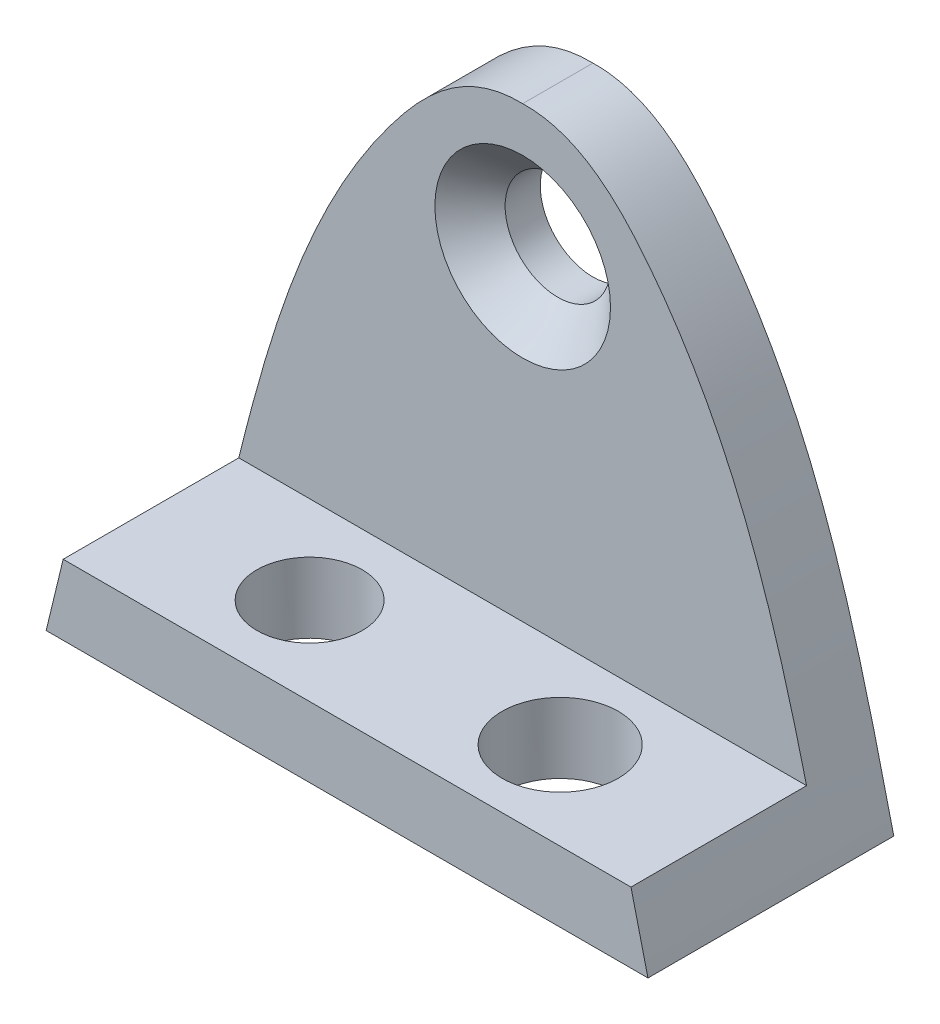
from build123d import *

# Parameters (mm, degrees)
SKETCH1_R           = 1.5
BOSS_EXTRUDE1_DEPTH = 2
CHAMFER1_SIZE       = 1
BOSS_EXTRUDE2_DEPTH = 5
SKETCH3_R           = 1.5
SKETCH3_R_2         = 1.654032004
CUT_EXTRUDE1_DEPTH  = 19.458358008


with BuildPart() as part:
    # Sketch1 → Boss-Extrude1 (new body)
    with BuildSketch(Plane.XY):
        with BuildLine():
            Line((8.566894072, -11), (-8.566894072, -11))
            add(Edge.make_bspline(
                [(0, 3.774563681), (-1.6213965, 3.815439451), (-6.14281173, -0.719191195), (-7.529582221, -6.667664167), (-8.566894072, -11)],
                knots=[0, 0, 0, 0, 0.251062994, 1, 1, 1, 1], degree=3))
            add(Edge.make_bspline(
                [(0, 3.774563681), (1.6213965, 3.815439451), (6.14281173, -0.719191195), (7.529582221, -6.667664167), (8.566894072, -11)],
                knots=[0, 0, 0, 0, 0.251062994, 1, 1, 1, 1], degree=3))
        make_face()
        Circle(SKETCH1_R, mode=Mode.SUBTRACT)
    extrude(amount=BOSS_EXTRUDE1_DEPTH)

    # Chamfer1
    chamfer1_edges = [part.edges().sort_by_distance(p)[0] for p in [
        (-1.5, 0, 2),
    ]]
    chamfer(chamfer1_edges, length=CHAMFER1_SIZE)

    # Sketch2 → Boss-Extrude2 (add)
    with BuildSketch(Plane.XY.offset(2)):
        with BuildLine():
            Line((-8.082865754, -9), (8.082865754, -9))
            add(Edge.make_bspline(
                [(8.566894072, -11), (8.407698636, -10.33511982), (8.248472773, -9.667349813), (8.082865754, -9)],
                knots=[0, 0, 0, 0, 0.114938775, 0.114938775, 0.114938775, 0.114938775], degree=3))
            Line((8.566894072, -11), (-8.566894072, -11))
            add(Edge.make_bspline(
                [(-8.082865754, -9), (-8.248472773, -9.667349813), (-8.407698636, -10.33511982), (-8.566894072, -11)],
                knots=[0.885061225, 0.885061225, 0.885061225, 0.885061225, 1, 1, 1, 1], degree=3))
        make_face()
    extrude(amount=BOSS_EXTRUDE2_DEPTH)

    # Sketch3 → Cut-Extrude1 (cut, through all)
    with BuildSketch(Plane.XZ.offset(11)):
        with Locations((-3.566894072, 4.5)):
            Circle(SKETCH3_R)
        with Locations((3.566894072, 4.5)):
            Circle(SKETCH3_R_2)
    extrude(amount=-CUT_EXTRUDE1_DEPTH, mode=Mode.SUBTRACT)


solid = part.part
